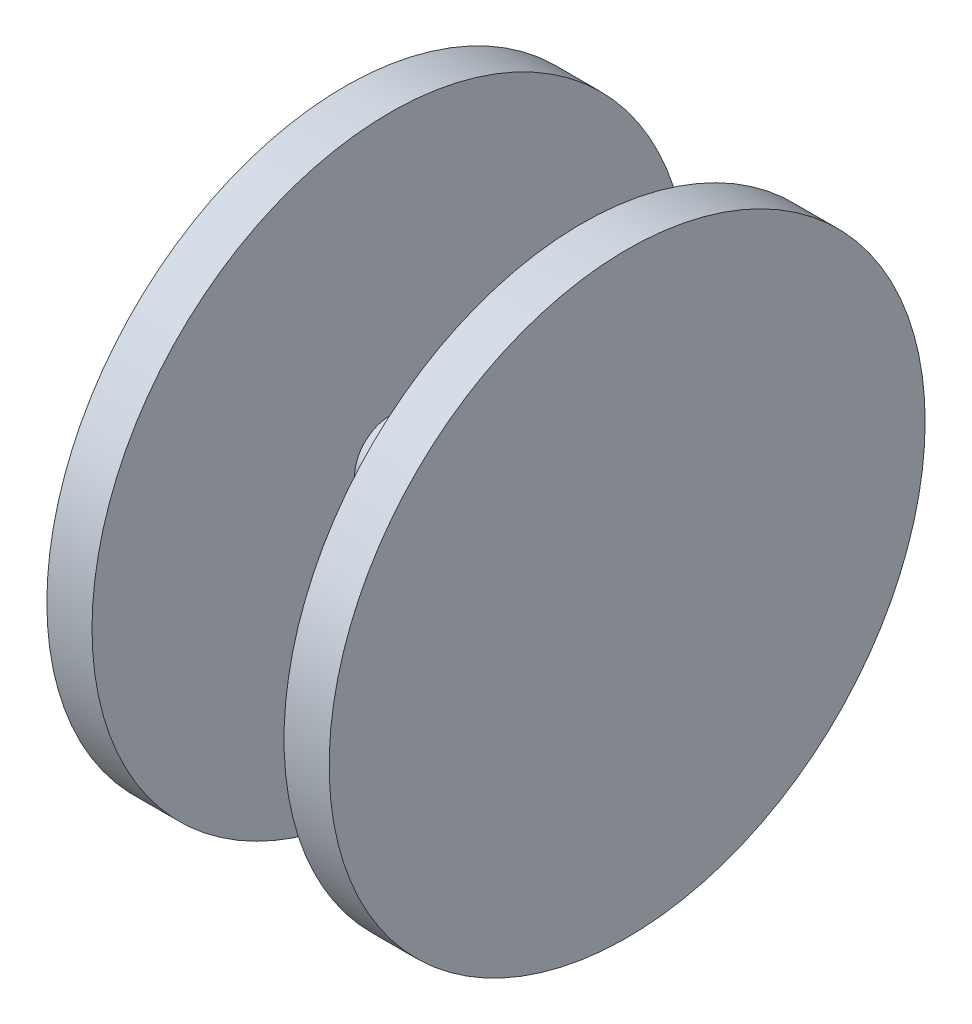
from build123d import *

# Parameters (mm, degrees)
SKETCH4_R           = 41.91
BOSS_EXTRUDE1_DEPTH = 6.35
SKETCH5_R           = 5
BOSS_EXTRUDE4_DEPTH = 27
BOSS_EXTRUDE5_START = 6.35
SKETCH7_R           = 41.91
BOSS_EXTRUDE5_DEPTH = 6.35


with BuildPart() as part:
    # Sketch4 → Boss-Extrude1 (new body)
    with BuildSketch(Plane(origin=(0, 0, 0), x_dir=(0, 0, -1), z_dir=(1, 0, 0))):
        Circle(SKETCH4_R)
    extrude(amount=BOSS_EXTRUDE1_DEPTH)

    # Sketch5 → Boss-Extrude4 (add)
    with BuildSketch(Plane.ZY):
        with Locations(Location((0, 0, 0), (0, 0, 180))):
            Circle(SKETCH5_R)
    extrude(amount=BOSS_EXTRUDE4_DEPTH)

    # Sketch7 → Boss-Extrude5 (add)
    with BuildSketch(Plane.ZY.offset(27).offset(BOSS_EXTRUDE5_START)):
        with Locations(Location((0, 0, 0), (0, 0, 180))):
            Circle(SKETCH7_R)
    extrude(amount=-BOSS_EXTRUDE5_DEPTH)


solid = part.part
